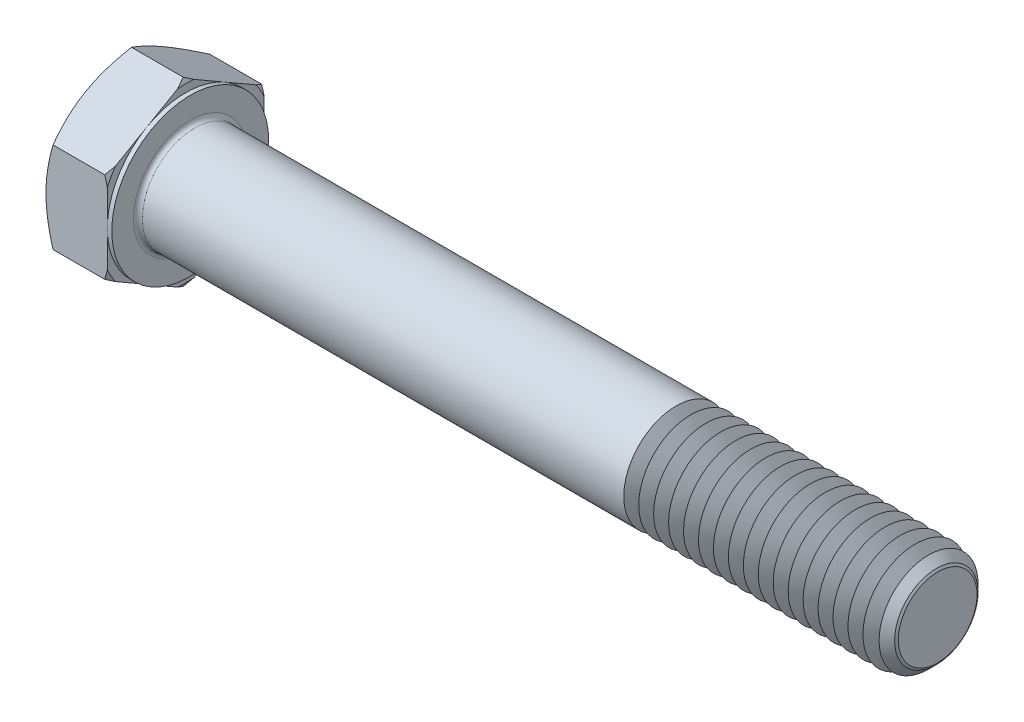
from build123d import *

# Parameters (mm, degrees)
EXTRUDE_517_DEPTH      = 8.8
SKETCH_4_W             = 0.6
SKETCH_4_H             = 11.624355653
CHAMFER_2189_SIZE      = 1.6
FILLET_2240_R          = 0.6
PATTERN_LINEAR_1_COUNT = 18
PATTERN_LINEAR_1_PITCH = 2


with BuildPart() as part:
    # 草图1 → Extrude 517 (new body)
    with BuildSketch(Plane(origin=(0, 0, 0), x_dir=(0, 0, -1), z_dir=(1, 0, 0))):
        Polygon((10.5, 6.062177826), (10.5, -6.062177826), (0, -12.124355653), (-10.5, -6.062177826), (-10.5, 6.062177826), (0, 12.124355653), align=None)
    extrude(amount=EXTRUDE_517_DEPTH)

    # 草图2 → 凸台-旋转1 (revolve)
    with BuildSketch(Plane.XY, mode=Mode.PRIVATE) as revolve_1_sk:
        Polygon((0, 0), (108.8, 0), (108.8, 5.268), (108.8, 7), (27.8072, 7), (0, 7), align=None)
    revolve(revolve_1_sk.sketch.rotate(Axis((0, 0, 0), (1, 0, 0)), 90), axis=Axis((0, 0, 0), (1, 0, 0)))

    # 草图3 → 切除-旋转1 (revolve, cut)
    with BuildSketch(Plane.XY):
        Polygon((0, 10.5), (3.824573519, 17.124355653), (3.824573519, 22.124355653), (-10, 22.124355653), (-10, 10.5), align=None)
    revolve(axis=Axis((0, 0, 0), (1, 0, 0)), mode=Mode.SUBTRACT)

    # 草图5 → 切除-旋转2 (revolve, cut)
    with BuildSketch(Plane.XY):
        Polygon((8.8, 10.5), (4.975426481, 17.124355653), (4.975426481, 22.124355653), (14.975426481, 22.124355653), (14.975426481, 10.5), align=None)
    revolve(axis=Axis((0, 0, 0), (1, 0, 0)), mode=Mode.SUBTRACT)

    # 草图4 → 切除-旋转3 (revolve, cut)
    with BuildSketch(Plane.XY, mode=Mode.PRIVATE) as cut_revolve_3_sk:
        with Locations((8.5, 16.312177827)):
            Rectangle(SKETCH_4_W, SKETCH_4_H)
    revolve(cut_revolve_3_sk.sketch.rotate(Axis((0, 0, 0), (1, 0, 0)), 270), axis=Axis((0, 0, 0), (1, 0, 0)), mode=Mode.SUBTRACT)

    # Chamfer 2189
    chamfer_2189_edges = [part.edges().sort_by_distance(p)[0] for p in [
        (108.8, 0, -7),
    ]]
    chamfer(chamfer_2189_edges, length=CHAMFER_2189_SIZE)

    # Fillet 2240
    fillet_2240_edges = [part.edges().sort_by_distance(p)[0] for p in [
        (8.8, 0, -7),
    ]]
    fillet(fillet_2240_edges, radius=FILLET_2240_R)

    # 草图6 → 切除-旋转4 (revolve, cut)
    with BuildSketch(Plane.XY):
        Polygon((74.8, -5.268), (73.800029334, -7), (73.800029334, -8.75), (75.799970666, -8.75), (75.799970666, -7), align=None)
    cut_revolve_4 = revolve(axis=Axis((-3.175, 0, 0), (1, 0, 0)), mode=Mode.SUBTRACT)

    # 阵列(线性)1: 切除-旋转4 ×18
    with Locations(*[(i * PATTERN_LINEAR_1_PITCH, 0, 0) for i in range(1, PATTERN_LINEAR_1_COUNT)]):
        add(cut_revolve_4, mode=Mode.SUBTRACT)


solid = part.part
